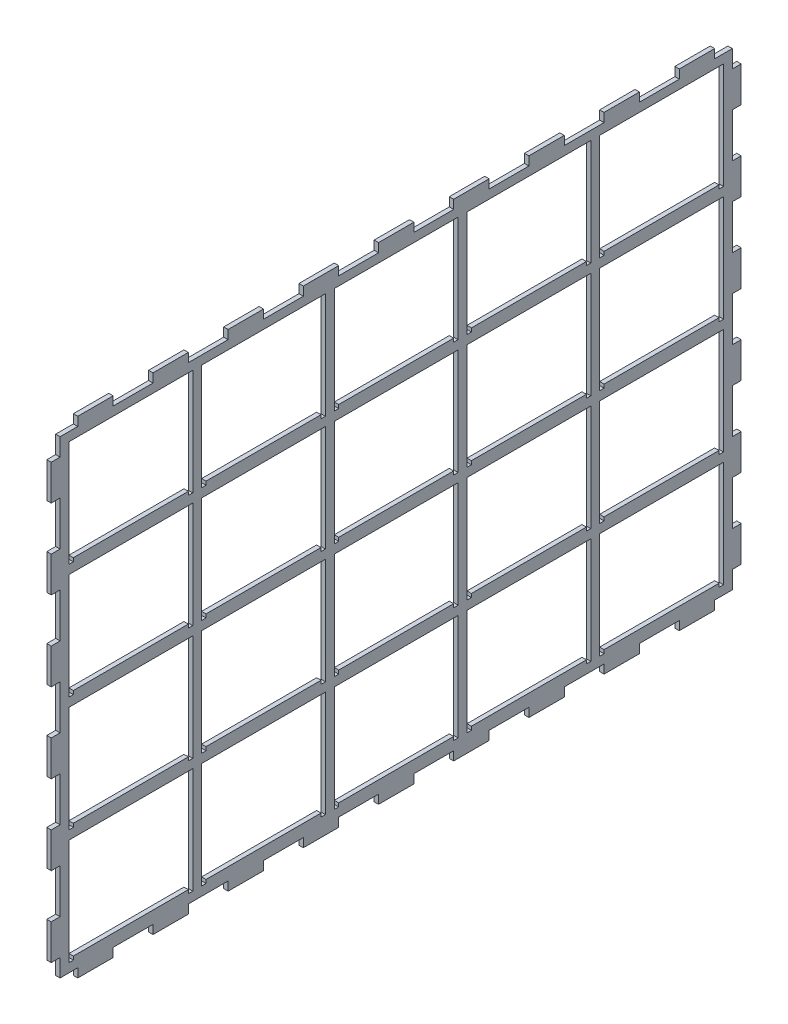
from build123d import *

# Parameters (mm, degrees)
BOSS_EXTRUDE1_DEPTH = 2.5


with BuildPart() as part:
    # Sketch1 → Boss-Extrude1 (new body)
    with BuildSketch(Plane(origin=(0, 0, 0), x_dir=(0, 0, -1), z_dir=(1, 0, 0))):
        Polygon((-180, 137.5), (-180, 132.5), (-190, 132.5), (-190, 122.5), (-195, 122.5), (-195, 102.5), (-190, 102.5), (-190, 77.5), (-195, 77.5), (-195, 57.5), (-190, 57.5), (-190, 32.5), (-195, 32.5), (-195, 12.5), (-190, 12.5), (-190, -12.5), (-195, -12.5), (-195, -32.5), (-190, -32.5), (-190, -57.5), (-195, -57.5), (-195, -77.5), (-190, -77.5), (-190, -102.5), (-195, -102.5), (-195, -122.5), (-190, -122.5), (-190, -132.5), (-180, -132.5), (-180, -137.5), (-160, -137.5), (-160, -132.5), (-137.5, -132.5), (-137.5, -137.5), (-117.5, -137.5), (-117.5, -132.5), (-95, -132.5), (-95, -137.5), (-75, -137.5), (-75, -132.5), (-52.5, -132.5), (-52.5, -137.5), (-32.5, -137.5), (-32.5, -132.5), (-10, -132.5), (-10, -137.5), (10, -137.5), (10, -132.5), (32.5, -132.5), (32.5, -137.5), (52.5, -137.5), (52.5, -132.5), (75, -132.5), (75, -137.5), (95, -137.5), (95, -132.5), (117.5, -132.5), (117.5, -137.5), (137.5, -137.5), (137.5, -132.5), (160, -132.5), (160, -137.5), (180, -137.5), (180, -132.5), (190, -132.5), (190, -122.5), (195, -122.5), (195, -102.5), (190, -102.5), (190, -77.5), (195, -77.5), (195, -57.5), (190, -57.5), (190, -32.5), (195, -32.5), (195, -12.5), (190, -12.5), (190, 12.5), (195, 12.5), (195, 32.5), (190, 32.5), (190, 57.5), (195, 57.5), (195, 77.5), (190, 77.5), (190, 102.5), (195, 102.5), (195, 122.5), (190, 122.5), (190, 132.5), (180, 132.5), (180, 137.5), (160, 137.5), (160, 132.5), (137.5, 132.5), (137.5, 137.5), (117.5, 137.5), (117.5, 132.5), (95, 132.5), (95, 137.5), (75, 137.5), (75, 132.5), (52.5, 132.5), (52.5, 137.5), (32.5, 137.5), (32.5, 132.5), (10, 132.5), (10, 137.5), (-10, 137.5), (-10, 132.5), (-32.5, 132.5), (-32.5, 137.5), (-52.5, 137.5), (-52.5, 132.5), (-75, 132.5), (-75, 137.5), (-95, 137.5), (-95, 132.5), (-117.5, 132.5), (-117.5, 137.5), (-137.5, 137.5), (-137.5, 132.5), (-160, 132.5), (-160, 137.5), align=None)
        Polygon((115, 67.5), (115, 127.5), (185, 127.5), (185, 67.5), (182.5, 67.5), (182.5, 69.5), (117.5, 69.5), (117.5, 67.5), align=None, mode=Mode.SUBTRACT)
        Polygon((115, 2.5), (115, 62.5), (185, 62.5), (185, 2.5), (182.5, 2.5), (182.5, 4.5), (117.5, 4.5), (117.5, 2.5), align=None, mode=Mode.SUBTRACT)
        Polygon((115, -62.5), (115, -2.5), (185, -2.5), (185, -62.5), (182.5, -62.5), (182.5, -60.5), (117.5, -60.5), (117.5, -62.5), align=None, mode=Mode.SUBTRACT)
        Polygon((115, -127.5), (115, -67.5), (185, -67.5), (185, -127.5), (182.5, -127.5), (182.5, -125.5), (117.5, -125.5), (117.5, -127.5), align=None, mode=Mode.SUBTRACT)
        Polygon((40, 67.5), (40, 127.5), (110, 127.5), (110, 67.5), (107.5, 67.5), (107.5, 69.5), (42.5, 69.5), (42.5, 67.5), align=None, mode=Mode.SUBTRACT)
        Polygon((40, 2.5), (40, 62.5), (110, 62.5), (110, 2.5), (107.5, 2.5), (107.5, 4.5), (42.5, 4.5), (42.5, 2.5), align=None, mode=Mode.SUBTRACT)
        Polygon((40, -62.5), (40, -2.5), (110, -2.5), (110, -62.5), (107.5, -62.5), (107.5, -60.5), (42.5, -60.5), (42.5, -62.5), align=None, mode=Mode.SUBTRACT)
        Polygon((40, -127.5), (40, -67.5), (110, -67.5), (110, -127.5), (107.5, -127.5), (107.5, -125.5), (42.5, -125.5), (42.5, -127.5), align=None, mode=Mode.SUBTRACT)
        Polygon((-35, 67.5), (-35, 127.5), (35, 127.5), (35, 67.5), (32.5, 67.5), (32.5, 69.5), (-32.5, 69.5), (-32.5, 67.5), align=None, mode=Mode.SUBTRACT)
        Polygon((-35, 2.5), (-35, 62.5), (35, 62.5), (35, 2.5), (32.5, 2.5), (32.5, 4.5), (-32.5, 4.5), (-32.5, 2.5), align=None, mode=Mode.SUBTRACT)
        Polygon((-35, -62.5), (-35, -2.5), (35, -2.5), (35, -62.5), (32.5, -62.5), (32.5, -60.5), (-32.5, -60.5), (-32.5, -62.5), align=None, mode=Mode.SUBTRACT)
        Polygon((-35, -127.5), (-35, -67.5), (35, -67.5), (35, -127.5), (32.5, -127.5), (32.5, -125.5), (-32.5, -125.5), (-32.5, -127.5), align=None, mode=Mode.SUBTRACT)
        Polygon((-110, 67.5), (-110, 127.5), (-40, 127.5), (-40, 67.5), (-42.5, 67.5), (-42.5, 69.5), (-107.5, 69.5), (-107.5, 67.5), align=None, mode=Mode.SUBTRACT)
        Polygon((-110, 2.5), (-110, 62.5), (-40, 62.5), (-40, 2.5), (-42.5, 2.5), (-42.5, 4.5), (-107.5, 4.5), (-107.5, 2.5), align=None, mode=Mode.SUBTRACT)
        Polygon((-110, -62.5), (-110, -2.5), (-40, -2.5), (-40, -62.5), (-42.5, -62.5), (-42.5, -60.5), (-107.5, -60.5), (-107.5, -62.5), align=None, mode=Mode.SUBTRACT)
        Polygon((-110, -127.5), (-110, -67.5), (-40, -67.5), (-40, -127.5), (-42.5, -127.5), (-42.5, -125.5), (-107.5, -125.5), (-107.5, -127.5), align=None, mode=Mode.SUBTRACT)
        Polygon((-185, 67.5), (-185, 127.5), (-115, 127.5), (-115, 67.5), (-117.5, 67.5), (-117.5, 69.5), (-182.5, 69.5), (-182.5, 67.5), align=None, mode=Mode.SUBTRACT)
        Polygon((-185, 2.5), (-185, 62.5), (-115, 62.5), (-115, 2.5), (-117.5, 2.5), (-117.5, 4.5), (-182.5, 4.5), (-182.5, 2.5), align=None, mode=Mode.SUBTRACT)
        Polygon((-185, -62.5), (-185, -2.5), (-115, -2.5), (-115, -62.5), (-117.5, -62.5), (-117.5, -60.5), (-182.5, -60.5), (-182.5, -62.5), align=None, mode=Mode.SUBTRACT)
        Polygon((-185, -127.5), (-185, -67.5), (-115, -67.5), (-115, -127.5), (-117.5, -127.5), (-117.5, -125.5), (-182.5, -125.5), (-182.5, -127.5), align=None, mode=Mode.SUBTRACT)
    extrude(amount=BOSS_EXTRUDE1_DEPTH)


solid = part.part
